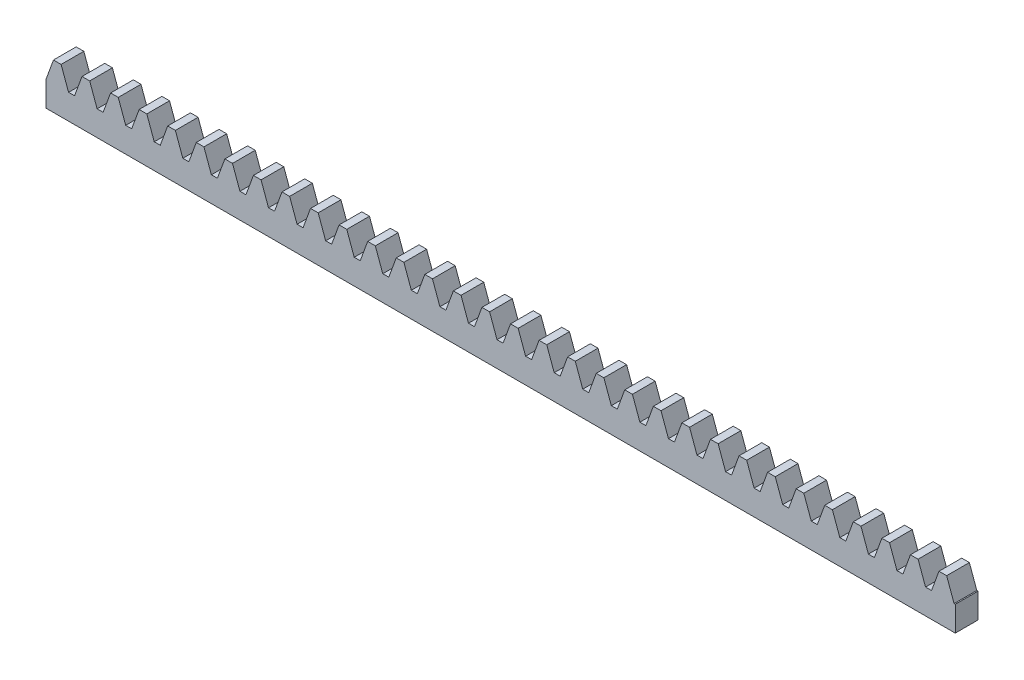
from build123d import *

# Parameters (mm, degrees)
SKETCH_1_W             = 200
SKETCH_1_H             = 5.5
EXTRUDE_1_DEPTH        = 5
EXTRUDE_2_DEPTH        = 5
PATTERN_LINEAR_1_COUNT = 32
PATTERN_LINEAR_1_PITCH = 6.283185307


with BuildPart() as part:
    # 草图1 → 拉伸1 (new body)
    with BuildSketch(Plane.XY):
        with Locations((100, -2.75)):
            Rectangle(SKETCH_1_W, SKETCH_1_H)
    extrude(amount=EXTRUDE_1_DEPTH)

    # 草图2 → 拉伸2 (add)
    with BuildSketch(Plane.XY.offset(5)):
        Polygon((0, 0), (1.637866054, 4.5), (3.323577771, 4.5), (4.961443825, 0), align=None)
    extrude_2 = extrude(amount=-EXTRUDE_2_DEPTH)

    # 阵列(线性)1: 拉伸2 ×32
    with Locations(*[(i * PATTERN_LINEAR_1_PITCH, 0, 0) for i in range(1, PATTERN_LINEAR_1_COUNT)]):
        add(extrude_2)


solid = part.part
